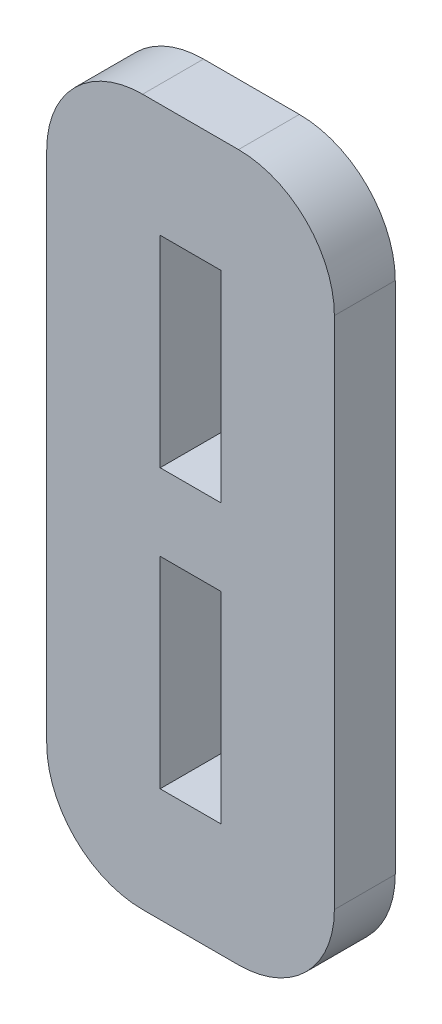
from build123d import *

# Parameters (mm, degrees)
SKETCH1_W           = 15
SKETCH1_H           = 36.825
SKETCH1_W_2         = 3.175
SKETCH1_H_2         = 10.5
BOSS_EXTRUDE1_DEPTH = 3.175
FILLET1_R           = 5


with BuildPart() as part:
    # Sketch1 → Boss-Extrude1 (new body)
    with BuildSketch(Plane.XY):
        with Locations((43.25, 40)):
            Rectangle(SKETCH1_W, SKETCH1_H)
        with Locations((43.25, 32.75)):
            Rectangle(SKETCH1_W_2, SKETCH1_H_2, mode=Mode.SUBTRACT)
        with Locations((43.25, 47.25)):
            Rectangle(SKETCH1_W_2, SKETCH1_H_2, mode=Mode.SUBTRACT)
    extrude(amount=BOSS_EXTRUDE1_DEPTH)

    # Fillet1
    fillet1_edges = [part.edges().sort_by_distance(p)[0] for p in [
        (50.75, 21.5875, 1.5875),
        (35.75, 21.5875, 1.5875),
        (35.75, 58.4125, 1.5875),
        (50.75, 58.4125, 1.5875),
    ]]
    fillet(fillet1_edges, radius=FILLET1_R)


solid = part.part
